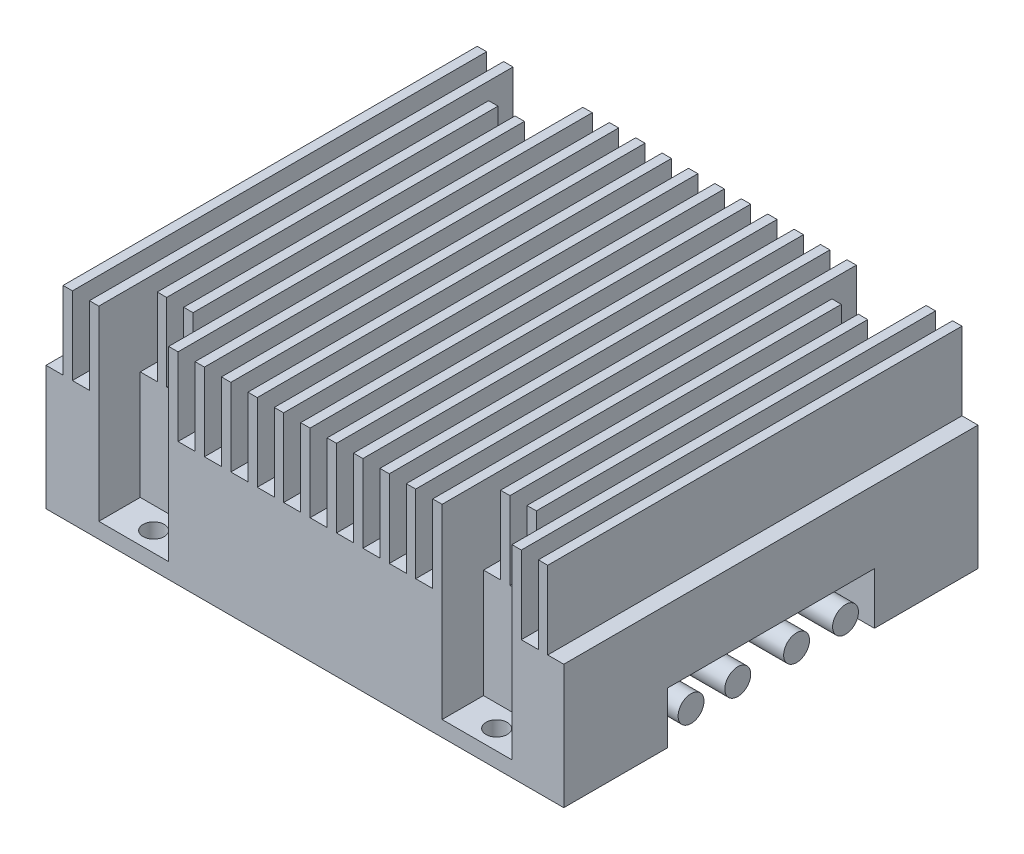
from build123d import *

# Parameters (mm, degrees)
SKETCH_1_W           = 100
SKETCH_1_H           = 80
EXTRUDE_1_DEPTH      = 39
SKETCH_2_W           = 3.287907932
SKETCH_2_H           = 80
CUT_EXTRUDE_1_DEPTH  = 15
SKETCH_3_W           = 13.487907932
SKETCH_3_H           = 8
CUT_EXTRUDE_2_DEPTH  = 21
SKETCH_3_2_W         = 13.487907932
SKETCH_3_2_H         = 8
CUT_EXTRUDE_3_DEPTH  = 15
SKETCH_4_W           = 13.487907932
SKETCH_4_H           = 8
CUT_EXTRUDE_4_DEPTH  = 21
SKETCH_4_3_W         = 13.487907932
SKETCH_4_3_H         = 8
CUT_EXTRUDE_5_DEPTH  = 15
SKETCH_5_W           = 13.487907932
SKETCH_5_H           = 8
CUT_EXTRUDE_6_DEPTH  = 21
SKETCH_5_2_W         = 13.487907932
SKETCH_5_2_H         = 8
CUT_EXTRUDE_7_DEPTH  = 15
SKETCH_6_W           = 13.487907932
SKETCH_6_H           = 8
CUT_EXTRUDE_8_DEPTH  = 21
SKETCH_6_2_W         = 13.487907932
SKETCH_6_2_H         = 8
CUT_EXTRUDE_9_DEPTH  = 36
SKETCH_7_R           = 2.05
CUT_EXTRUDE_10_DEPTH = 3
SKETCH_8_R           = 2.05
CUT_EXTRUDE_11_DEPTH = 3
SKETCH_9_R           = 2.05
CUT_EXTRUDE_12_DEPTH = 3
SKETCH_10_R          = 2.05
CUT_EXTRUDE_13_DEPTH = 3
SKETCH_11_W          = 40
SKETCH_11_H          = 20
CUT_EXTRUDE_14_DEPTH = 10
SKETCH_12_R          = 2.5
EXTRUDE_2_DEPTH      = 10


with BuildPart() as part:
    # 草图1 → 凸台-拉伸1 (new body)
    with BuildSketch(Plane(origin=(0, 0, 0), x_dir=(1, 0, 0), z_dir=(0, 1, 0))):
        Rectangle(SKETCH_1_W, SKETCH_1_H)
    extrude(amount=EXTRUDE_1_DEPTH)

    # 草图2 → 切除-拉伸1 (cut)
    with BuildSketch(Plane(origin=(0, 39, 0), x_dir=(1, 0, 0), z_dir=(0, 1, 0))):
        with Locations((-48.356046034, 0)):
            Rectangle(SKETCH_2_W, SKETCH_2_H)
        with Locations((-43.256046034, 0)):
            Rectangle(SKETCH_2_W, SKETCH_2_H)
        with Locations((-38.156046034, 0)):
            Rectangle(SKETCH_2_W, SKETCH_2_H)
        with Locations((-33.056046034, 0)):
            Rectangle(SKETCH_2_W, SKETCH_2_H)
        with Locations((-27.956046034, 0)):
            Rectangle(SKETCH_2_W, SKETCH_2_H)
        with Locations((-22.856046034, 0)):
            Rectangle(SKETCH_2_W, SKETCH_2_H)
        with Locations((-17.756046034, 0)):
            Rectangle(SKETCH_2_W, SKETCH_2_H)
        with Locations((-12.656046034, 0)):
            Rectangle(SKETCH_2_W, SKETCH_2_H)
        with Locations((-7.556046034, 0)):
            Rectangle(SKETCH_2_W, SKETCH_2_H)
        with Locations((-2.456046034, 0)):
            Rectangle(SKETCH_2_W, SKETCH_2_H)
        with Locations((2.643953966, 0)):
            Rectangle(SKETCH_2_W, SKETCH_2_H)
        with Locations((7.743953966, 0)):
            Rectangle(SKETCH_2_W, SKETCH_2_H)
        with Locations((12.843953966, 0)):
            Rectangle(SKETCH_2_W, SKETCH_2_H)
        with Locations((17.943953966, 0)):
            Rectangle(SKETCH_2_W, SKETCH_2_H)
        with Locations((23.043953966, 0)):
            Rectangle(SKETCH_2_W, SKETCH_2_H)
        with Locations((28.143953966, 0)):
            Rectangle(SKETCH_2_W, SKETCH_2_H)
        with Locations((33.243953966, 0)):
            Rectangle(SKETCH_2_W, SKETCH_2_H)
        with Locations((38.343953966, 0)):
            Rectangle(SKETCH_2_W, SKETCH_2_H)
        with Locations((43.443953966, 0)):
            Rectangle(SKETCH_2_W, SKETCH_2_H)
        with Locations((48.543953966, 0)):
            Rectangle(SKETCH_2_W, SKETCH_2_H)
    extrude(amount=-CUT_EXTRUDE_1_DEPTH, mode=Mode.SUBTRACT)

    # 草图3 → 切除-拉伸2 (cut)
    with BuildSketch(Plane(origin=(0, 24, 0), x_dir=(1, 0, 0), z_dir=(0, 1, 0))):
        with Locations((-33.056046034, 36)):
            Rectangle(SKETCH_3_W, SKETCH_3_H)
    extrude(amount=-CUT_EXTRUDE_2_DEPTH, mode=Mode.SUBTRACT)

    # 草图3<2> → 切除-拉伸3 (cut)
    with BuildSketch(Plane(origin=(0, 24, 0), x_dir=(1, 0, 0), z_dir=(0, 1, 0))):
        with Locations((-33.056046034, 36)):
            Rectangle(SKETCH_3_2_W, SKETCH_3_2_H)
    extrude(amount=CUT_EXTRUDE_3_DEPTH, mode=Mode.SUBTRACT)

    # 草图4 → 切除-拉伸4 (cut)
    with BuildSketch(Plane(origin=(0, 24, 0), x_dir=(1, 0, 0), z_dir=(0, 1, 0))):
        with Locations((33.243953966, 36)):
            Rectangle(SKETCH_4_W, SKETCH_4_H)
    extrude(amount=-CUT_EXTRUDE_4_DEPTH, mode=Mode.SUBTRACT)

    # 草图4<3> → 切除-拉伸5 (cut)
    with BuildSketch(Plane(origin=(0, 24, 0), x_dir=(1, 0, 0), z_dir=(0, 1, 0))):
        with Locations((33.243953966, 36)):
            Rectangle(SKETCH_4_3_W, SKETCH_4_3_H)
    extrude(amount=CUT_EXTRUDE_5_DEPTH, mode=Mode.SUBTRACT)

    # 草图5 → 切除-拉伸6 (cut)
    with BuildSketch(Plane(origin=(0, 24, 0), x_dir=(1, 0, 0), z_dir=(0, 1, 0))):
        with Locations((-33.056046034, -36)):
            Rectangle(SKETCH_5_W, SKETCH_5_H)
    extrude(amount=-CUT_EXTRUDE_6_DEPTH, mode=Mode.SUBTRACT)

    # 草图5<2> → 切除-拉伸7 (cut)
    with BuildSketch(Plane(origin=(0, 24, 0), x_dir=(1, 0, 0), z_dir=(0, 1, 0))):
        with Locations((-33.056046034, -36)):
            Rectangle(SKETCH_5_2_W, SKETCH_5_2_H)
    extrude(amount=CUT_EXTRUDE_7_DEPTH, mode=Mode.SUBTRACT)

    # 草图6 → 切除-拉伸8 (cut)
    with BuildSketch(Plane(origin=(0, 39, 0), x_dir=(1, 0, 0), z_dir=(0, 1, 0))):
        with Locations((33.243953966, -36)):
            Rectangle(SKETCH_6_W, SKETCH_6_H)
    extrude(amount=-CUT_EXTRUDE_8_DEPTH, mode=Mode.SUBTRACT)

    # 草图6<2> → 切除-拉伸9 (cut)
    with BuildSketch(Plane(origin=(0, 39, 0), x_dir=(1, 0, 0), z_dir=(0, 1, 0))):
        with Locations((33.243953966, -36)):
            Rectangle(SKETCH_6_2_W, SKETCH_6_2_H)
    extrude(amount=-CUT_EXTRUDE_9_DEPTH, mode=Mode.SUBTRACT)

    # 草图7 → 切除-拉伸10 (cut)
    with BuildSketch(Plane(origin=(0, 3, 0), x_dir=(1, 0, 0), z_dir=(0, 1, 0))):
        with Locations((-33.395851618, 36.021594171)):
            Circle(SKETCH_7_R)
    extrude(amount=-CUT_EXTRUDE_10_DEPTH, mode=Mode.SUBTRACT)

    # 草图8 → 切除-拉伸11 (cut)
    with BuildSketch(Plane(origin=(0, 3, 0), x_dir=(1, 0, 0), z_dir=(0, 1, 0))):
        with Locations((33.312820736, 35.94065507)):
            Circle(SKETCH_8_R)
    extrude(amount=-CUT_EXTRUDE_11_DEPTH, mode=Mode.SUBTRACT)

    # 草图9 → 切除-拉伸12 (cut)
    with BuildSketch(Plane(origin=(0, 3, 0), x_dir=(1, 0, 0), z_dir=(0, 1, 0))):
        with Locations((-32.970812698, -36.238015002)):
            Circle(SKETCH_9_R)
    extrude(amount=-CUT_EXTRUDE_12_DEPTH, mode=Mode.SUBTRACT)

    # 草图10 → 切除-拉伸13 (cut)
    with BuildSketch(Plane(origin=(0, 3, 0), x_dir=(1, 0, 0), z_dir=(0, 1, 0))):
        with Locations((33.252132878, -36.225040763)):
            Circle(SKETCH_10_R)
    extrude(amount=-CUT_EXTRUDE_13_DEPTH, mode=Mode.SUBTRACT)

    # 草图11 → 切除-拉伸14 (cut)
    with BuildSketch(Plane(origin=(50, 0, 0), x_dir=(0, 0, -1), z_dir=(1, 0, 0))):
        Rectangle(SKETCH_11_W, SKETCH_11_H)
    extrude(amount=-CUT_EXTRUDE_14_DEPTH, mode=Mode.SUBTRACT)

    # 草图12 → 凸台-拉伸2 (add)
    with BuildSketch(Plane(origin=(40, 0, 0), x_dir=(0, 0, -1), z_dir=(1, 0, 0))):
        with Locations((-15.422086217, 4.286980586)):
            Circle(SKETCH_12_R)
        with Locations((-6.396528349, 4.286980586)):
            Circle(SKETCH_12_R)
        with Locations((4.962166927, 4.286980586)):
            Circle(SKETCH_12_R)
        with Locations((14.417513265, 4.286980586)):
            Circle(SKETCH_12_R)
    extrude(amount=EXTRUDE_2_DEPTH)


solid = part.part
